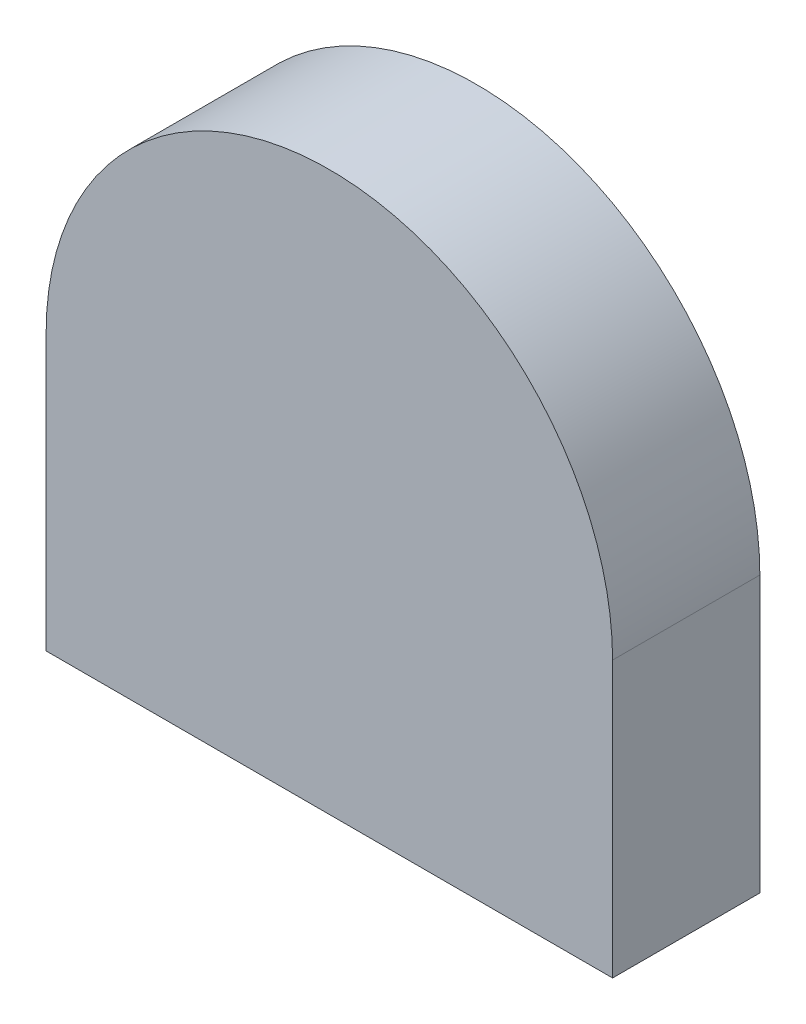
from build123d import *

# Parameters (mm, degrees)
ESQUISSE1_R             = 14
BOSS_EXTRU_1_DEPTH      = 13
BOSS_EXTRU_2_START      = -2
ESQUISSE3_R             = 14
BOSS_EXTRU_2_DEPTH      = 2
ESQUISSE4_W             = 13
ESQUISSE4_H             = 10.015892944
ENL_V_MAT_EXTRU_1_DEPTH = 60


with BuildPart() as part:
    # Esquisse1 → Boss.-Extru.1 (new body)
    with BuildSketch(Plane.XY):
        with BuildLine():
            ThreePointArc((-25, 0), (0, 25), (25, 0))
            Line((25, 0), (25, -32.475372295))
            Line((25, -32.475372295), (-25, -32.475372295))
            Line((-25, -32.475372295), (-25, 0))
        make_face()
        with Locations(Location((0, 0, 0), (0, 0, 180))):
            Circle(ESQUISSE1_R, mode=Mode.SUBTRACT)
    extrude(amount=BOSS_EXTRU_1_DEPTH)

    # Esquisse3 → Boss.-Extru.2 (add)
    with BuildSketch(Plane.XY.offset(13).offset(BOSS_EXTRU_2_START)):
        with Locations(Location((0, 0, 0), (0, 0, 180))):
            Circle(ESQUISSE3_R)
    extrude(amount=BOSS_EXTRU_2_DEPTH)

    # Esquisse4 → Enlèv. mat.-Extru.1 (cut)
    with BuildSketch(Plane.ZY.offset(25)):
        with Locations((6.5, -29.313318767)):
            Rectangle(ESQUISSE4_W, ESQUISSE4_H)
    extrude(amount=-ENL_V_MAT_EXTRU_1_DEPTH, mode=Mode.SUBTRACT)


solid = part.part
